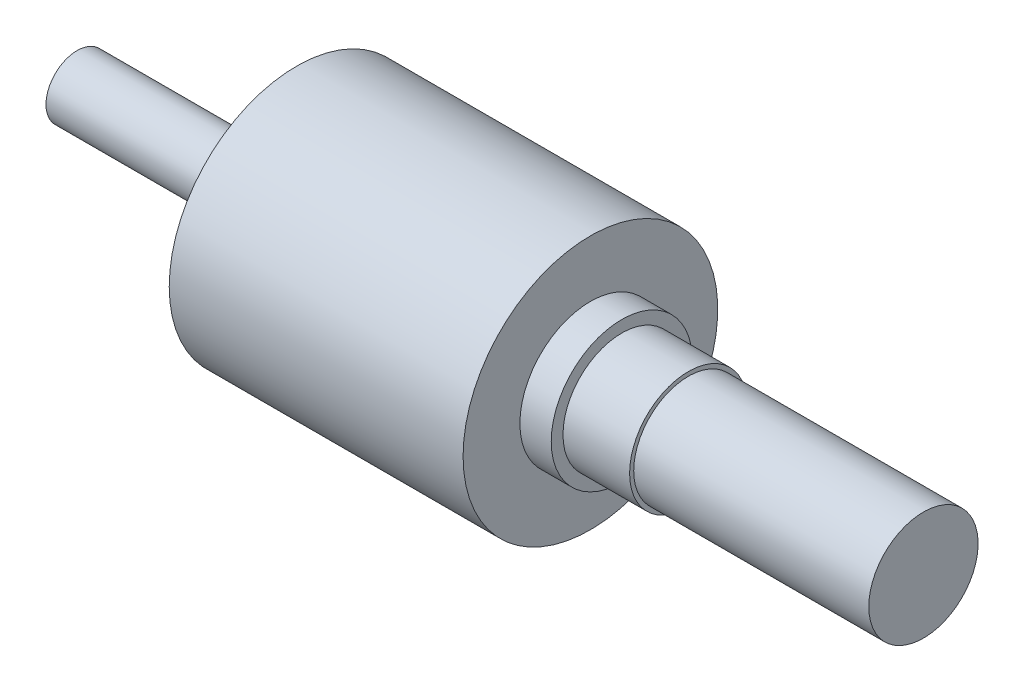
from build123d import *


with BuildPart() as part:
    # Çizim1 → Döndür1 (revolve)
    with BuildSketch(Plane.XY, mode=Mode.PRIVATE) as d_nd_r1_sk:
        Polygon((0, 0), (0, 3.975), (24, 3.975), (24, 6), (28, 6), (28, 16.25), (65.5, 16.25), (65.5, 9), (69.5, 9), (69.5, 7.5), (78, 7.5), (78, 6.975), (108, 6.975), (108, 0), align=None)
    revolve(d_nd_r1_sk.sketch.rotate(Axis((0, 0, 0), (1, 0, 0)), 90), axis=Axis((0, 0, 0), (1, 0, 0)))


solid = part.part
